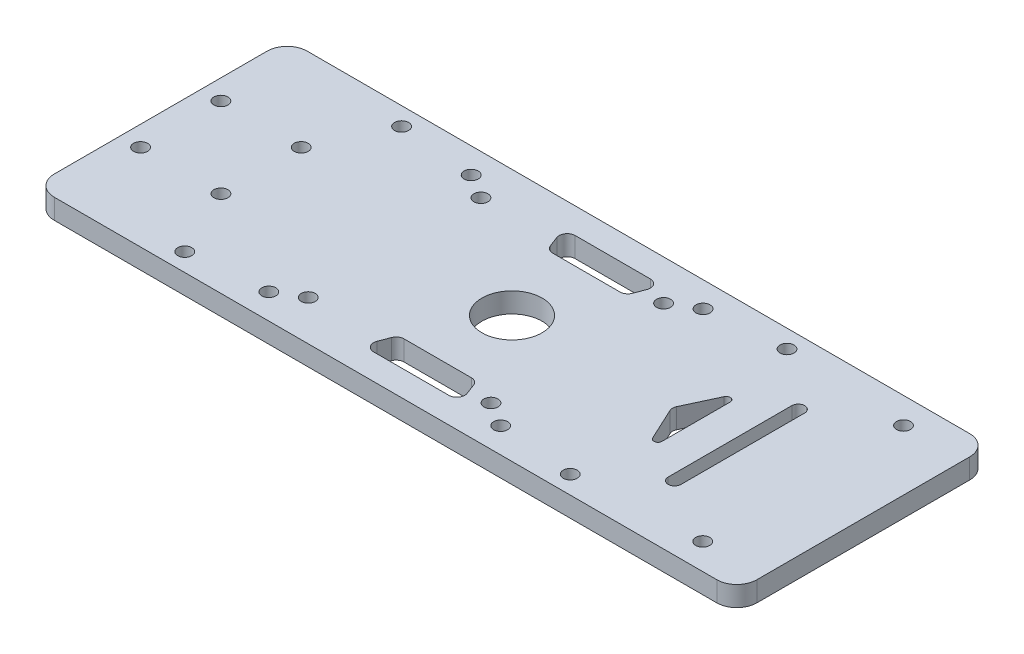
from build123d import *

# Parameters (mm, degrees)
SKETCH1_W           = 175
SKETCH1_H           = 63
BOSS_EXTRUDE1_DEPTH = 2.5
SKETCH2_R           = 1.75
CUT_EXTRUDE1_DEPTH  = 94.131627281
SKETCH3_R           = 7.5
CUT_EXTRUDE2_DEPTH  = 94.131627281
FILLET1_R           = 5
SKETCH4_R           = 1.75
CUT_EXTRUDE3_DEPTH  = 94.131627281


with BuildPart() as part:
    # Sketch1 → Boss-Extrude1 (new, symmetric)
    with BuildSketch(Plane(origin=(0, 0, 0), x_dir=(1, 0, 0), z_dir=(0, 1, 0))):
        Rectangle(SKETCH1_W, SKETCH1_H)
    extrude(amount=BOSS_EXTRUDE1_DEPTH, both=True)

    # Sketch2 → Cut-Extrude1 (cut, through all)
    with BuildSketch(Plane(origin=(0, 2.5, 0), x_dir=(1, 0, 0), z_dir=(0, 1, 0))):
        with Locations(Location((-82.5, 10, 0), (0, 0, 270))):
            Circle(SKETCH2_R)
        with Locations(Location((-62.5, 10, 0), (0, 0, 270))):
            Circle(SKETCH2_R)
        with Locations(Location((-54.5, 27, 0), (0, 0, 270))):
            Circle(SKETCH2_R)
        with Locations(Location((-35.37, 25.2, 0), (0, 0, 270))):
            Circle(SKETCH2_R)
        with Locations(Location((-29.24, 21.5, 0), (0, 0, 270))):
            Circle(SKETCH2_R)
        with Locations(Location((22.38, 25.2, 0), (0, 0, 270))):
            Circle(SKETCH2_R)
        with Locations(Location((16.26, 21.5, 0), (0, 0, 270))):
            Circle(SKETCH2_R)
        with Locations(Location((41.5, 27, 0), (0, 0, 270))):
            Circle(SKETCH2_R)
        with Locations(Location((41.5, -27, 0), (0, 0, 90))):
            Circle(SKETCH2_R)
        with Locations(Location((22.38, -25.2, 0), (0, 0, 90))):
            Circle(SKETCH2_R)
        with Locations(Location((16.26, -21.5, 0), (0, 0, 90))):
            Circle(SKETCH2_R)
        with Locations(Location((-29.24, -21.5, 0), (0, 0, 90))):
            Circle(SKETCH2_R)
        with Locations(Location((-35.37, -25.2, 0), (0, 0, 90))):
            Circle(SKETCH2_R)
        with Locations(Location((-62.5, -10, 0), (0, 0, 90))):
            Circle(SKETCH2_R)
        with Locations(Location((-54.5, -27, 0), (0, 0, 90))):
            Circle(SKETCH2_R)
        with Locations(Location((-82.5, -10, 0), (0, 0, 90))):
            Circle(SKETCH2_R)
    extrude(amount=-CUT_EXTRUDE1_DEPTH, mode=Mode.SUBTRACT)

    # Sketch3 → Cut-Extrude2 (cut, through all)
    with BuildSketch(Plane(origin=(0, 2.5, 0), x_dir=(1, 0, 0), z_dir=(0, 1, 0))):
        with BuildLine():
            ThreePointArc((-10.239221922, 19.791545875), (-9.505365031, 18.85426183), (-8.368903032, 18.5))
            Line((-8.368903032, 18.5), (8.368903032, 18.5))
            ThreePointArc((8.368903032, 18.5), (9.505365031, 18.85426183), (10.239221922, 19.791545875))
            Line((10.239221922, 19.791545875), (11.224070407, 22.391545875))
            ThreePointArc((11.224070407, 22.391545875), (10.999489687, 24.236461999), (9.353751517, 25.1))
            Line((9.353751517, 25.1), (-9.353751517, 25.1))
            ThreePointArc((-9.353751517, 25.1), (-10.999489687, 24.236461999), (-11.224070407, 22.391545875))
            Line((-11.224070407, 22.391545875), (-10.239221922, 19.791545875))
        make_face()
        with BuildLine():
            Line((45.85, -8.489291496), (45.85, 8.489291496))
            ThreePointArc((45.85, 8.489291496), (45.066439614, 9.465587503), (43.943692213, 8.911909758))
            Line((43.943692213, 8.911909758), (40.182140708, 0.845236523))
            ThreePointArc((40.182140708, 0.845236523), (39.994756282, 0), (40.182140708, -0.845236523))
            Line((40.182140708, -0.845236523), (43.943692213, -8.911909758))
            ThreePointArc((43.943692213, -8.911909758), (45.066439614, -9.465587503), (45.85, -8.489291496))
        make_face()
        with BuildLine():
            Line((-9.353751517, -25.1), (9.353751517, -25.1))
            ThreePointArc((9.353751517, -25.1), (10.999489687, -24.236461999), (11.224070407, -22.391545875))
            Line((11.224070407, -22.391545875), (10.239221922, -19.791545875))
            ThreePointArc((10.239221922, -19.791545875), (9.505365031, -18.85426183), (8.368903032, -18.5))
            Line((8.368903032, -18.5), (-8.368903032, -18.5))
            ThreePointArc((-8.368903032, -18.5), (-9.505365031, -18.85426183), (-10.239221922, -19.791545875))
            Line((-10.239221922, -19.791545875), (-11.224070407, -22.391545875))
            ThreePointArc((-11.224070407, -22.391545875), (-10.999489687, -24.236461999), (-9.353751517, -25.1))
        make_face()
        with BuildLine():
            Line((57.5, -15.4), (57.5, 15.4))
            ThreePointArc((57.5, 15.4), (55.9, 17), (54.3, 15.4))
            Line((54.3, 15.4), (54.3, -15.4))
            ThreePointArc((54.3, -15.4), (55.9, -17), (57.5, -15.4))
        make_face()
        with Locations(Location((0, 0, 0), (0, 0, 270))):
            Circle(SKETCH3_R)
    extrude(amount=-CUT_EXTRUDE2_DEPTH, mode=Mode.SUBTRACT)

    # Fillet1
    fillet1_edges = [part.edges().sort_by_distance(p)[0] for p in [
        (87.5, 0, 31.5),
        (-87.5, 0, 31.5),
        (-87.5, 0, -31.5),
        (87.5, 0, -31.5),
    ]]
    fillet(fillet1_edges, radius=FILLET1_R)

    # Sketch4 → Cut-Extrude3 (cut, through all)
    with BuildSketch(Plane(origin=(0, 2.5, 0), x_dir=(1, 0, 0), z_dir=(0, 1, 0))):
        with Locations(Location((72.5, 25, 0), (0, 0, 270))):
            Circle(SKETCH4_R)
        with Locations(Location((72.5, -25, 0), (0, 0, 270))):
            Circle(SKETCH4_R)
    extrude(amount=-CUT_EXTRUDE3_DEPTH, mode=Mode.SUBTRACT)


solid = part.part
